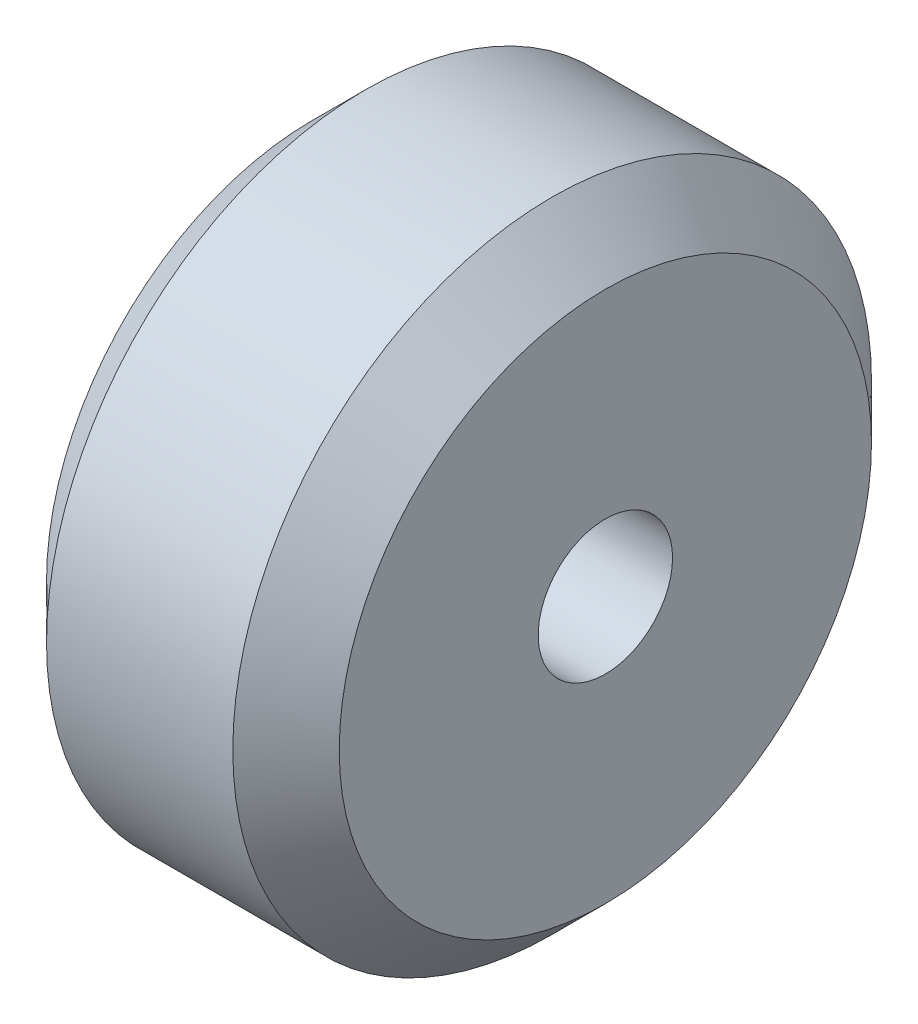
from build123d import *

# Parameters (mm, degrees)
SKETCH1_R           = 12
SKETCH1_R_2         = 2.525
BOSS_EXTRUDE1_DEPTH = 11
CHAMFER1_SIZE       = 2


with BuildPart() as part:
    # Sketch1 → Boss-Extrude1 (new body)
    with BuildSketch(Plane(origin=(0, 0, 0), x_dir=(0, 0, -1), z_dir=(1, 0, 0))):
        Circle(SKETCH1_R)
        Circle(SKETCH1_R_2, mode=Mode.SUBTRACT)
    extrude(amount=BOSS_EXTRUDE1_DEPTH)

    # Chamfer1
    chamfer1_edges = [part.edges().sort_by_distance(p)[0] for p in [
        (0, 0, 12),
        (11, 0, 12),
    ]]
    chamfer(chamfer1_edges, length=CHAMFER1_SIZE)


solid = part.part
